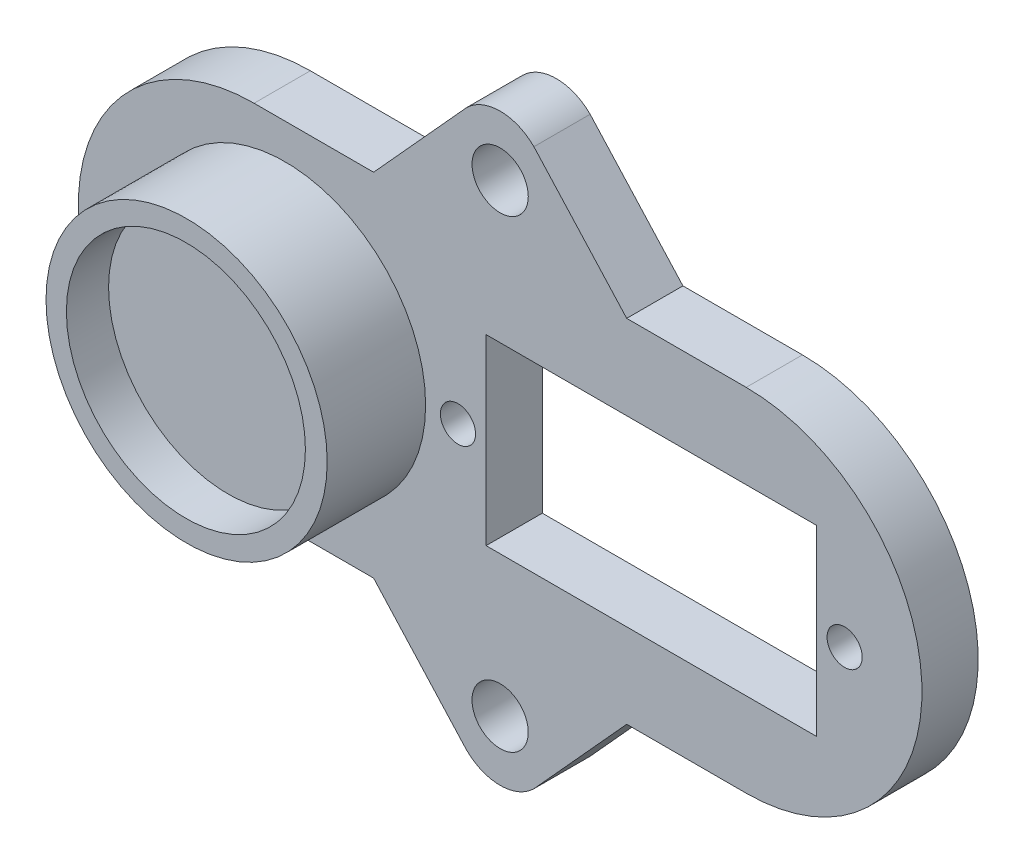
from build123d import *

# Parameters (mm, degrees)
SKETCH1_R           = 2
SKETCH1_R_2         = 1.25
SKETCH1_W           = 23.5
SKETCH1_H           = 13
BOSS_EXTRUDE1_DEPTH = 4
SKETCH3_R           = 10
BOSS_EXTRUDE2_DEPTH = 7
SKETCH4_R           = 8.5
CUT_EXTRUDE1_DEPTH  = 3


with BuildPart() as part:
    # Sketch1 → Boss-Extrude1 (new body)
    with BuildSketch(Plane.XY):
        with BuildLine():
            Line((-9, 12.5), (-2.401010284, 19.772380391))
            ThreePointArc((-2.401010284, 19.772380391), (0, 20.766911414), (2.401010284, 19.772380391))
            Line((2.401010284, 19.772380391), (9, 12.5))
            Line((9, 12.5), (17.5, 12.5))
            ThreePointArc((17.5, 12.5), (30, 0), (17.5, -12.5))
            Line((17.5, -12.5), (9, -12.5))
            Line((9, -12.5), (2.401010284, -19.772380391))
            ThreePointArc((2.401010284, -19.772380391), (0, -20.766911414), (-2.401010284, -19.772380391))
            Line((-2.401010284, -19.772380391), (-9, -12.5))
            Line((-9, -12.5), (-17.5, -12.5))
            ThreePointArc((-17.5, -12.5), (-30, 0), (-17.5, 12.5))
            Line((-17.5, 12.5), (-9, 12.5))
        make_face()
        with Locations((0, 16.5)):
            Circle(SKETCH1_R, mode=Mode.SUBTRACT)
        with Locations(Location((0, -16.5, 0), (0, 0, 180))):
            Circle(SKETCH1_R, mode=Mode.SUBTRACT)
        with Locations((-3, 0)):
            Circle(SKETCH1_R_2, mode=Mode.SUBTRACT)
        with Locations((24.5, 0)):
            Circle(SKETCH1_R_2, mode=Mode.SUBTRACT)
        with Locations((10.75, 0)):
            Rectangle(SKETCH1_W, SKETCH1_H, mode=Mode.SUBTRACT)
    extrude(amount=BOSS_EXTRUDE1_DEPTH)

    # Sketch3 → Boss-Extrude2 (add)
    with BuildSketch(Plane.XY.offset(4)):
        with Locations((-15.3, 0)):
            Circle(SKETCH3_R)
    extrude(amount=BOSS_EXTRUDE2_DEPTH)

    # Sketch4 → Cut-Extrude1 (cut)
    with BuildSketch(Plane.XY.offset(11)):
        with Locations((-15.35, 0)):
            Circle(SKETCH4_R)
    extrude(amount=-CUT_EXTRUDE1_DEPTH, mode=Mode.SUBTRACT)


solid = part.part
